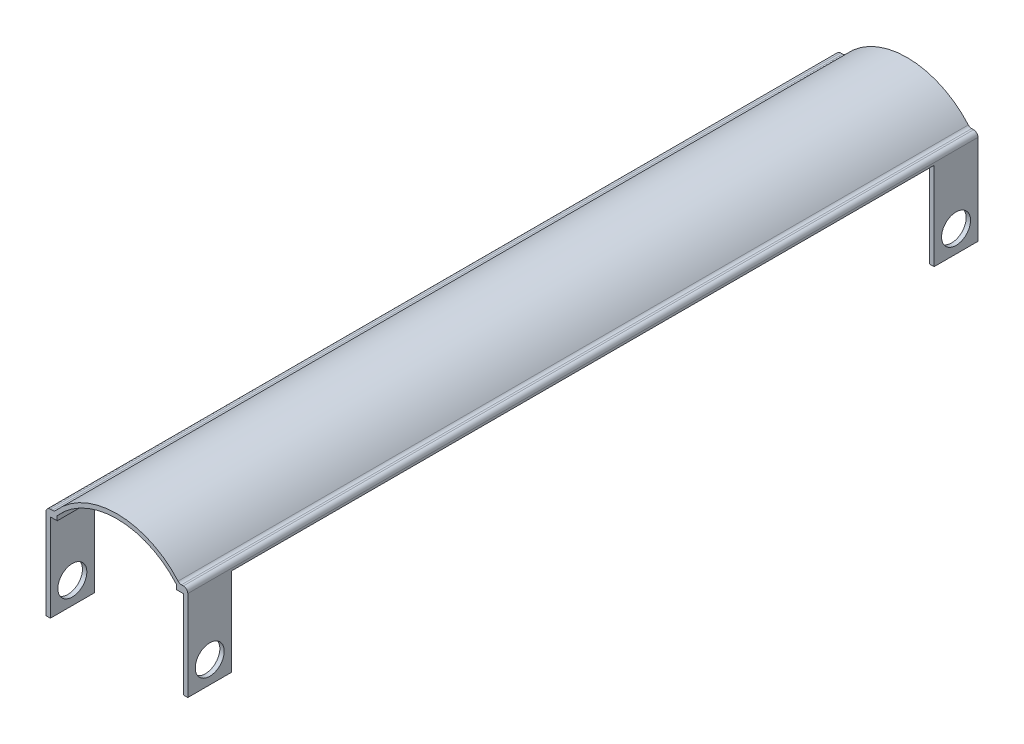
from build123d import *

# Parameters (mm, degrees)
AUFSATZ_LINEAR_AUSTRAGEN1_DEPTH = 180
DURCHGANGSLOCH_F_R_M61_D        = 6.6
SKIZZE4_W                       = 160
SKIZZE4_H                       = 20
SCHNITT_LINEAR_AUSTRAGEN1_DEPTH = 185.137137843
VERRUNDUNG1_R                   = 1


with BuildPart() as part:
    # Skizze1 → Aufsatz-Linear austragen1 (new body)
    with BuildSketch(Plane.XY):
        with BuildLine():
            Line((-16.15, 0), (-14.230984974, 0))
            ThreePointArc((-14.230984974, 0), (0, 6.679295001), (14.230984974, 0))
            Line((14.230984974, 0), (16.15, 0))
            Line((16.15, 0), (16.15, -21.521977909))
            Line((16.15, -21.521977909), (15.15, -21.521977909))
            Line((15.15, -21.521977909), (15.15, -1.521977909))
            Line((15.15, -1.521977909), (15, -1.521977909))
            Line((15, -1.521977909), (13.59375, -1.521977909))
            Line((13.59375, -1.521977909), (13.59375, -0.521977909))
            ThreePointArc((13.59375, -0.521977909), (0, 5.679295001), (-13.59375, -0.521977909))
            Line((-13.59375, -0.521977909), (-13.59375, -1.521977909))
            Line((-13.59375, -1.521977909), (-15, -1.521977909))
            Line((-15, -1.521977909), (-15.15, -1.521977909))
            Line((-15.15, -1.521977909), (-15.15, -21.521977909))
            Line((-15.15, -21.521977909), (-16.15, -21.521977909))
            Line((-16.15, -21.521977909), (-16.15, 0))
        make_face()
    extrude(amount=AUFSATZ_LINEAR_AUSTRAGEN1_DEPTH)

    # Durchgangsloch für M61 (through all)
    with Locations(Plane(origin=(-16.15, 0, 0), x_dir=(0, 0, -1), z_dir=(-1, 0, 0))):
        with Locations((-5, 16.521977909)):
            durchgangsloch_f_r_m61 = Hole(DURCHGANGSLOCH_F_R_M61_D / 2)

    # Spiegeln1: Durchgangsloch für M61 across plane
    add(durchgangsloch_f_r_m61.mirror(Plane.XY.offset(90)), mode=Mode.SUBTRACT)

    # Skizze4 → Schnitt-Linear austragen1 (cut, through all)
    with BuildSketch(Plane(origin=(16.15, 0, 0), x_dir=(0, 0, -1), z_dir=(1, 0, 0))):
        with Locations((-90, -11.521977909)):
            Rectangle(SKIZZE4_W, SKIZZE4_H)
    extrude(amount=-SCHNITT_LINEAR_AUSTRAGEN1_DEPTH, mode=Mode.SUBTRACT)

    # Verrundung1
    verrundung1_edges = [part.edges().sort_by_distance(p)[0] for p in [
        (14.230984974, 0, 90),
        (16.15, 0, 90),
        (-16.15, 0, 90),
        (-14.230984974, 0, 90),
    ]]
    fillet(verrundung1_edges, radius=VERRUNDUNG1_R)


solid = part.part
